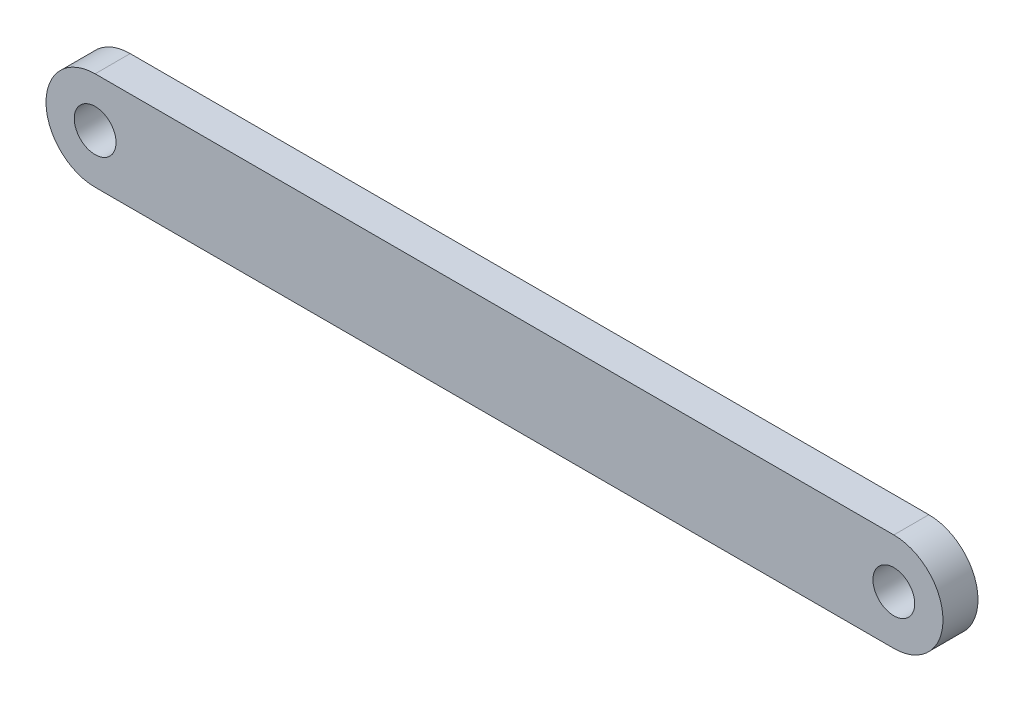
from build123d import *

# Parameters (mm, degrees)
SKETCH1_W           = 100
SKETCH1_H           = 8
BOSS_EXTRUDE1_DEPTH = 2.85
CUT_EXTRUDE1_DEPTH  = 51.240645896
SKETCH3_R           = 1.7
CUT_EXTRUDE2_DEPTH  = 51.240645896
SKETCH4_R           = 1.7
CUT_EXTRUDE3_DEPTH  = 51.240645896
CUT_EXTRUDE4_DEPTH  = 51.240645896


with BuildPart() as part:
    # Sketch1 → Boss-Extrude1 (new body)
    with BuildSketch(Plane.XY):
        Rectangle(SKETCH1_W, SKETCH1_H)
    extrude(amount=BOSS_EXTRUDE1_DEPTH)

    # Sketch2 → Cut-Extrude1 (cut, through all)
    with BuildSketch(Plane.XY.offset(2.85)):
        with BuildLine():
            Line((46, -4), (51, -4))
            Line((51, -4), (51, 4))
            Line((51, 4), (46, 4))
            ThreePointArc((46, 4), (50, 0), (46, -4))
        make_face()
    cut_extrude1 = extrude(amount=-CUT_EXTRUDE1_DEPTH, mode=Mode.SUBTRACT)

    # Sketch3 → Cut-Extrude2 (cut, through all)
    with BuildSketch(Plane.XY.offset(2.85)):
        with Locations((46, 0)):
            Circle(SKETCH3_R)
    cut_extrude2 = extrude(amount=-CUT_EXTRUDE2_DEPTH, mode=Mode.SUBTRACT)

    # Mirror1: Cut-Extrude1, Cut-Extrude2 across plane
    add(cut_extrude1.mirror(Plane(origin=(0, 0, 0), x_dir=(0, 0, 1), z_dir=(1, 0, 0))), mode=Mode.SUBTRACT)
    add(cut_extrude2.mirror(Plane(origin=(0, 0, 0), x_dir=(0, 0, 1), z_dir=(1, 0, 0))), mode=Mode.SUBTRACT)

    # Sketch4 → Cut-Extrude3 (cut, through all)
    with BuildSketch(Plane.XY.offset(2.85)):
        with Locations((-19, 0)):
            Circle(SKETCH4_R)
    extrude(amount=-CUT_EXTRUDE3_DEPTH, mode=Mode.SUBTRACT)

    # Sketch5 → Cut-Extrude4 (cut, through all)
    with BuildSketch(Plane.XY.offset(2.85)):
        with BuildLine():
            Line((-19, 4), (-50, 4))
            Line((-50, 4), (-50, -4))
            Line((-50, -4), (-19, -4))
            ThreePointArc((-19, -4), (-23, 0), (-19, 4))
        make_face()
    extrude(amount=-CUT_EXTRUDE4_DEPTH, mode=Mode.SUBTRACT)


solid = part.part
